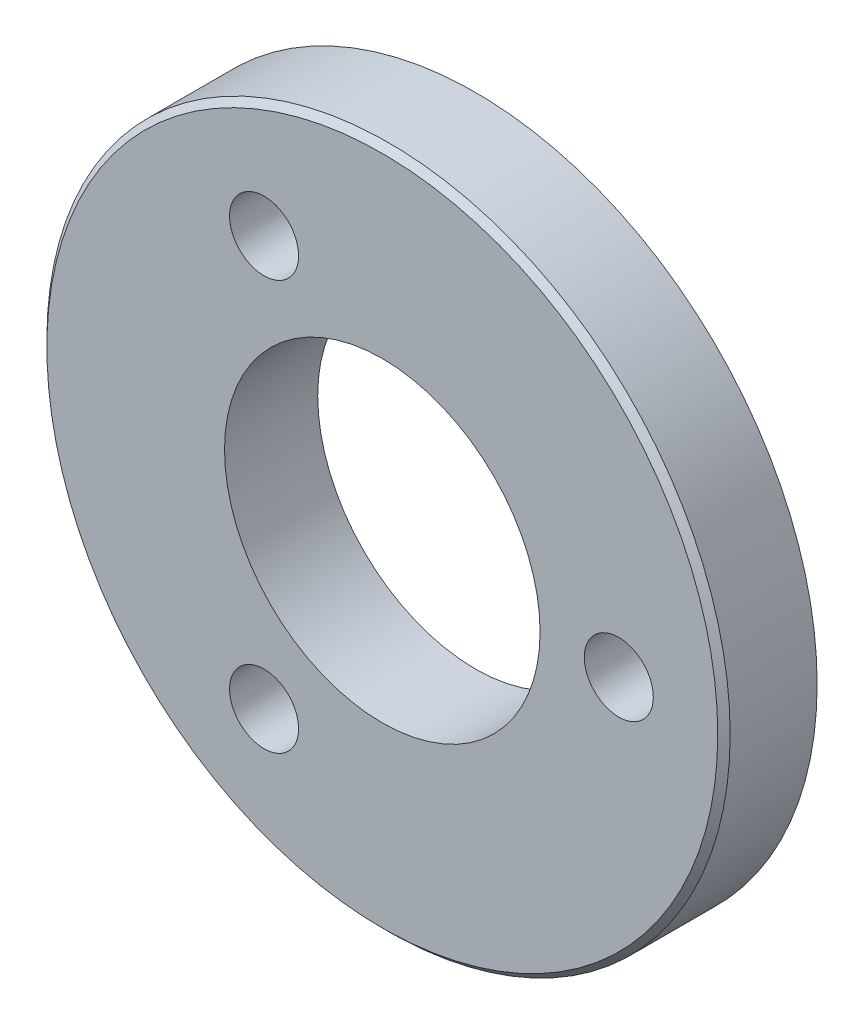
from build123d import *

# Parameters (mm, degrees)
SKETCH1_R           = 27.5
SKETCH1_R_2         = 2.778125
SKETCH1_R_3         = 12.7
BOSS_EXTRUDE1_DEPTH = 7.5
CHAMFER1_SIZE       = 0.5


with BuildPart() as part:
    # Sketch1 → Boss-Extrude1 (new body)
    with BuildSketch(Plane.XY):
        Circle(SKETCH1_R)
        with Locations((-9.5170625, 16.484035789)):
            Circle(SKETCH1_R_2, mode=Mode.SUBTRACT)
        with Locations((19.034125, 0)):
            Circle(SKETCH1_R_2, mode=Mode.SUBTRACT)
        with Locations((-9.5170625, -16.484035789)):
            Circle(SKETCH1_R_2, mode=Mode.SUBTRACT)
        Circle(SKETCH1_R_3, mode=Mode.SUBTRACT)
    extrude(amount=BOSS_EXTRUDE1_DEPTH)

    # Chamfer1
    chamfer1_edges = [part.edges().sort_by_distance(p)[0] for p in [
        (-27.5, 0, 7.5),
    ]]
    chamfer(chamfer1_edges, length=CHAMFER1_SIZE)


solid = part.part
